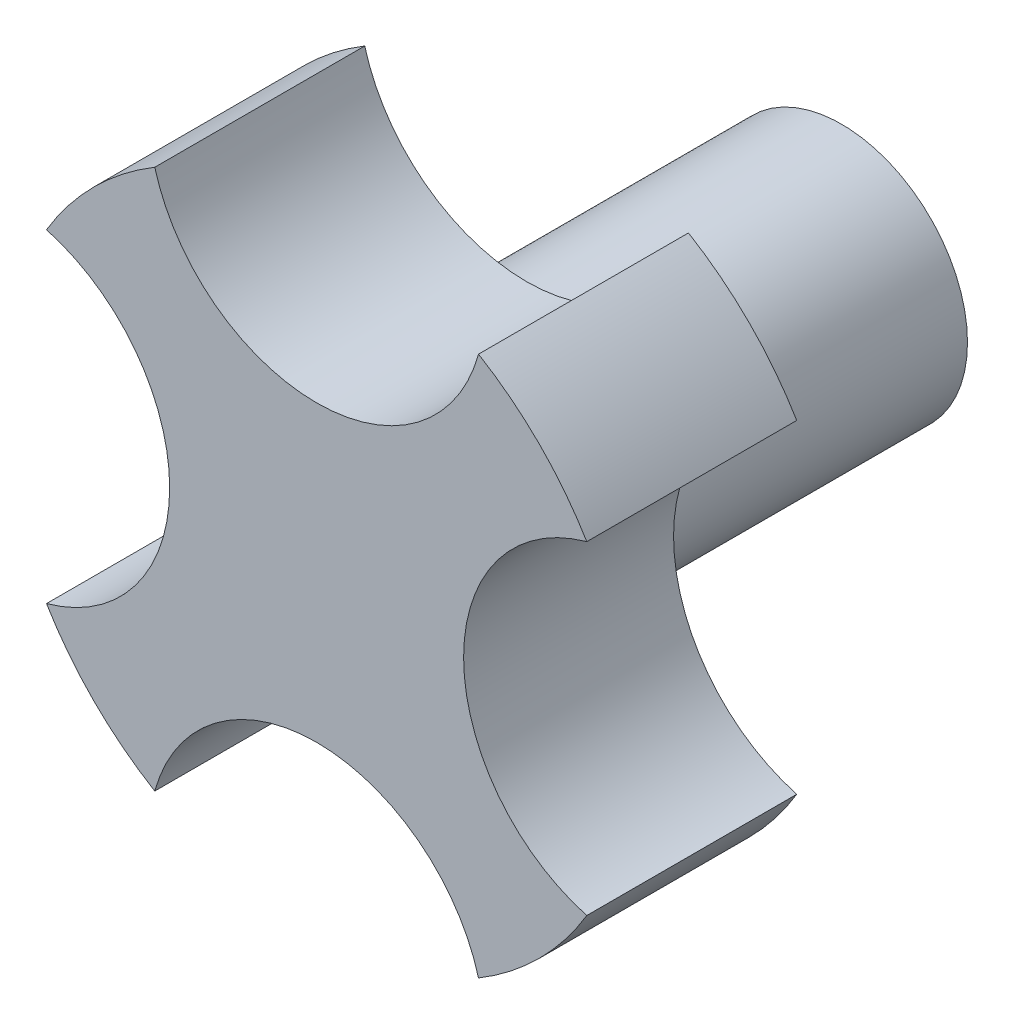
from build123d import *

# Parameters (mm, degrees)
IZIM1_R                     = 6
IZIM1_R_2                   = 4
Y_KSEKLIK_EKSTR_ZYON1_DEPTH = 15
Y_KSEKLIK_EKSTR_ZYON2_DEPTH = 10
KES_EKSTR_ZYON1_DEPTH       = 15
DAIRESEL_KAPLAMA1_COUNT     = 2
DAIRESEL_KAPLAMA1_ANGLE     = 90


with BuildPart() as part:
    # Çizim1 → Yükseklik-Ekstrüzyon1 (new body)
    with BuildSketch(Plane.XY):
        Circle(IZIM1_R)
        Circle(IZIM1_R_2, mode=Mode.SUBTRACT)
    extrude(amount=Y_KSEKLIK_EKSTR_ZYON1_DEPTH)

    # Çizim2 → Yükseklik-Ekstrüzyon2 (add)
    with BuildSketch(Plane.XY.offset(15)):
        with BuildLine():
            ThreePointArc((-7.710310557, 12.866666667), (-10.606601718, 10.606601718), (-12.866666667, 7.710310557))
            ThreePointArc((-12.866666667, 7.710310557), (-7, 0), (-12.866666667, -7.710310557))
            ThreePointArc((-12.866666667, -7.710310557), (-10.606601718, -10.606601718), (-7.710310557, -12.866666667))
            ThreePointArc((-7.710310557, -12.866666667), (0, -7), (7.710310557, -12.866666667))
            ThreePointArc((7.710310557, -12.866666667), (10.606601718, -10.606601718), (12.866666667, -7.710310557))
            ThreePointArc((12.866666667, -7.710310557), (7, 0), (12.866666667, 7.710310557))
            ThreePointArc((12.866666667, 7.710310557), (10.606601718, 10.606601718), (7.710310557, 12.866666667))
            ThreePointArc((7.710310557, 12.866666667), (0, 7), (-7.710310557, 12.866666667))
        make_face()
    extrude(amount=Y_KSEKLIK_EKSTR_ZYON2_DEPTH)

    # Çizim3 → Kes-Ekstrüzyon1 (cut)
    with BuildSketch(Plane(origin=(0, 0, 0), x_dir=(1, 0, 0), z_dir=(0, 1, 0))):
        with BuildLine():
            ThreePointArc((1.5, -7.5), (1.060660172, -6.439339828), (0, -6))
            Line((0, -6), (0, -9))
            ThreePointArc((0, -9), (1.060660172, -8.560660172), (1.5, -7.5))
        make_face()
        with BuildLine():
            Line((0, -9), (0, -6))
            ThreePointArc((0, -6), (-1.5, -7.5), (0, -9))
        make_face()
    kes_ekstr_zyon1 = extrude(amount=-KES_EKSTR_ZYON1_DEPTH, mode=Mode.SUBTRACT)

    # Dairesel Kaplama1: Kes-Ekstrüzyon1 ×2 about axis
    dairesel_kaplama1_axis = Axis((0, 0, 15), (0, 0, -1))
    for i in range(1, DAIRESEL_KAPLAMA1_COUNT):
        add(kes_ekstr_zyon1.rotate(dairesel_kaplama1_axis, i * DAIRESEL_KAPLAMA1_ANGLE / (DAIRESEL_KAPLAMA1_COUNT - 1)), mode=Mode.SUBTRACT)


solid = part.part
